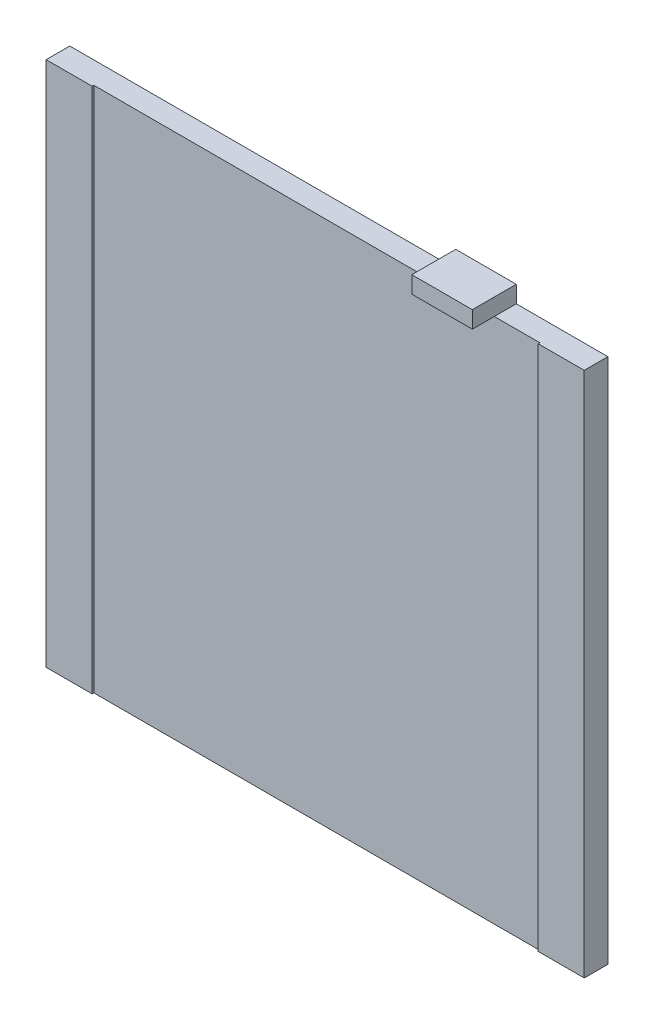
from build123d import *

# Parameters (mm, degrees)
SKETCH1_W           = 159.25
SKETCH1_H           = 155.74
BOSS_EXTRUDE1_DEPTH = 6.5
SKETCH2_W           = 13.61
SKETCH2_H           = 155.74
BOSS_EXTRUDE2_DEPTH = 0.5
SKETCH3_W           = 17.92
SKETCH3_H           = 13
BOSS_EXTRUDE3_DEPTH = 5


with BuildPart() as part:
    # Sketch1 → Boss-Extrude1 (new body)
    with BuildSketch(Plane.XY):
        with Locations((79.625, 77.87)):
            Rectangle(SKETCH1_W, SKETCH1_H)
    extrude(amount=BOSS_EXTRUDE1_DEPTH)

    # Sketch2 → Boss-Extrude2 (add)
    with BuildSketch(Plane.XY.offset(6.5)):
        with Locations((6.805, 77.87)):
            Rectangle(SKETCH2_W, SKETCH2_H)
        with Locations((152.445, 77.87)):
            Rectangle(SKETCH2_W, SKETCH2_H)
    extrude(amount=BOSS_EXTRUDE2_DEPTH)

    # Sketch3 → Boss-Extrude3 (add)
    with BuildSketch(Plane(origin=(0, 155.74, 0), x_dir=(1, 0, 0), z_dir=(0, 1, 0))):
        with Locations((123.18, -6.5)):
            Rectangle(SKETCH3_W, SKETCH3_H)
    extrude(amount=BOSS_EXTRUDE3_DEPTH)


solid = part.part
